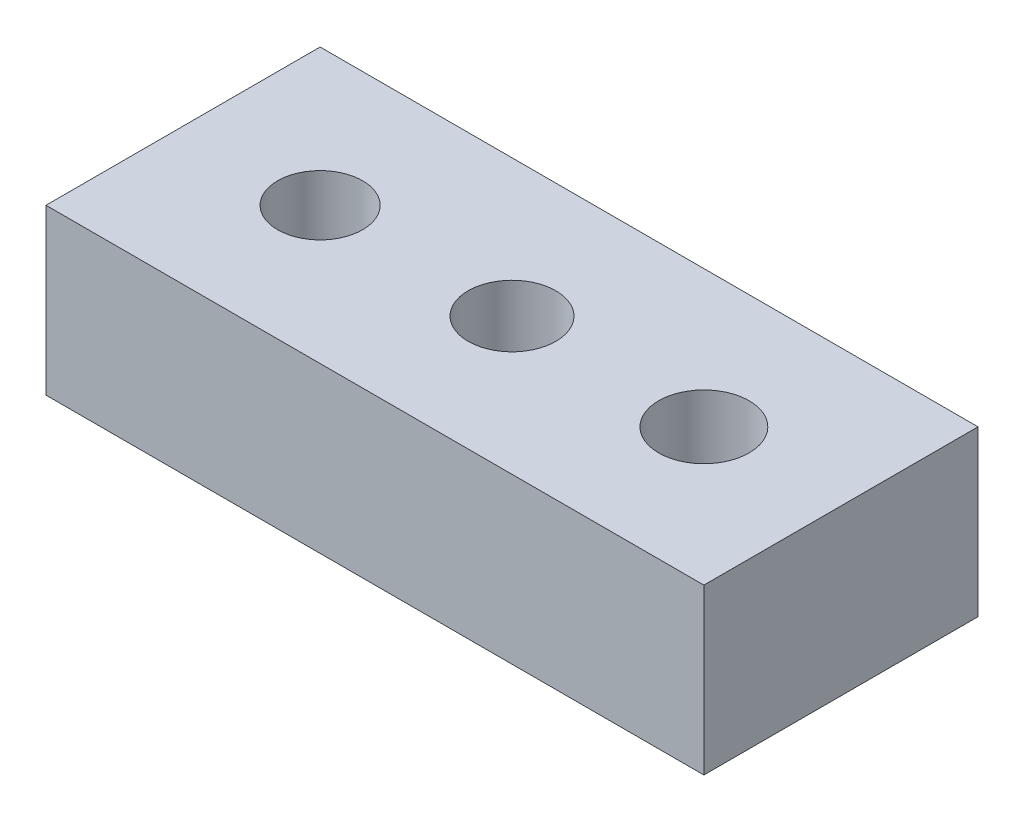
from build123d import *

# Parameters (mm, degrees)
SKETCH_1_W      = 24
SKETCH_1_H      = 10
SKETCH_1_R      = 1.55
SKETCH_1_R_2    = 1.6
SKETCH_1_R_3    = 1.65
EXTRUDE_1_DEPTH = 6


with BuildPart() as part:
    # 草图1 → 凸台-拉伸1 (new body)
    with BuildSketch(Plane(origin=(0, 0, 0), x_dir=(1, 0, 0), z_dir=(0, 1, 0))):
        with Locations((12, 5)):
            Rectangle(SKETCH_1_W, SKETCH_1_H)
        with Locations(Location((5, 5, 0), (0, 0, 270))):
            Circle(SKETCH_1_R, mode=Mode.SUBTRACT)
        with Locations(Location((12, 5, 0), (0, 0, 270))):
            Circle(SKETCH_1_R_2, mode=Mode.SUBTRACT)
        with Locations(Location((19, 5, 0), (0, 0, 270))):
            Circle(SKETCH_1_R_3, mode=Mode.SUBTRACT)
    extrude(amount=EXTRUDE_1_DEPTH)


solid = part.part
